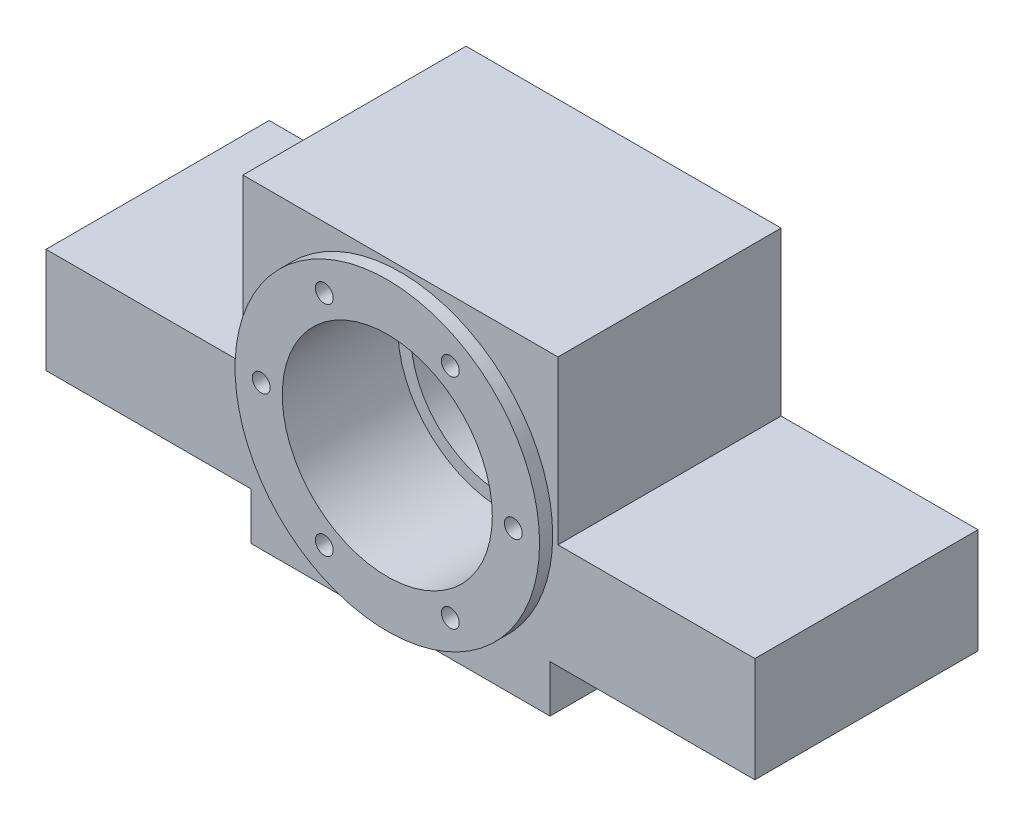
from build123d import *

# Parameters (mm, degrees)
EXTRUDE_1_DEPTH          = 85
SKETCH_2_R               = 58
EXTRUDE_2_DEPTH          = 5
SKETCH_3_R               = 40
CUT_EXTRUDE_1_DEPTH      = 44
SKETCH_4_R               = 35
CUT_EXTRUDE_2_DEPTH      = 187.38937738
PATTERN_CIRCULAR_1_COUNT = 6


with BuildPart() as part:
    # 草图1 → 凸台-拉伸1 (new body)
    with BuildSketch(Plane.XY):
        Polygon((0, 0), (-57, 0), (-57, 18), (-135, 18), (-135, 58), (-60, 58), (-60, 120), (60, 120), (60, 58), (135, 58), (135, 18), (57, 18), (57, 0), align=None)
    extrude(amount=-EXTRUDE_1_DEPTH)

    # 草图2 → 凸台-拉伸2 (add)
    with BuildSketch(Plane.XY):
        with Locations((0, 60)):
            Circle(SKETCH_2_R)
    extrude(amount=EXTRUDE_2_DEPTH)

    # 草图3 → 切除-拉伸1 (cut)
    with BuildSketch(Plane.XY.offset(5)):
        with Locations((0, 60)):
            Circle(SKETCH_3_R)
    extrude(amount=-CUT_EXTRUDE_1_DEPTH, mode=Mode.SUBTRACT)

    # 草图4 → 切除-拉伸2 (cut, through all)
    with BuildSketch(Plane.XY.offset(-39)):
        with Locations((0, 60)):
            Circle(SKETCH_4_R)
    extrude(amount=-CUT_EXTRUDE_2_DEPTH, mode=Mode.SUBTRACT)

    # 草图7 → M8 螺纹孔1 (revolve, cut)
    with BuildSketch(Plane(origin=(24, 101.569219382, 5), x_dir=(0, -1, 0), z_dir=(1, 0, 0))):
        Polygon((0, 0), (0, 29.802926105), (3.4, 27.76), (3.4, 0), align=None)
    hole_wizard_m8_1 = revolve(axis=Axis((24, 101.569219382, 11.35), (0, 0, -1)), mode=Mode.SUBTRACT)

    # 阵列(圆周)1: M8 螺纹孔1 ×6 about axis
    pattern_circular_1_axis = Axis((0, 60, 0), (0, 0, 1))
    for i in range(1, PATTERN_CIRCULAR_1_COUNT):
        add(hole_wizard_m8_1.rotate(pattern_circular_1_axis, i * 360 / PATTERN_CIRCULAR_1_COUNT), mode=Mode.SUBTRACT)


solid = part.part
